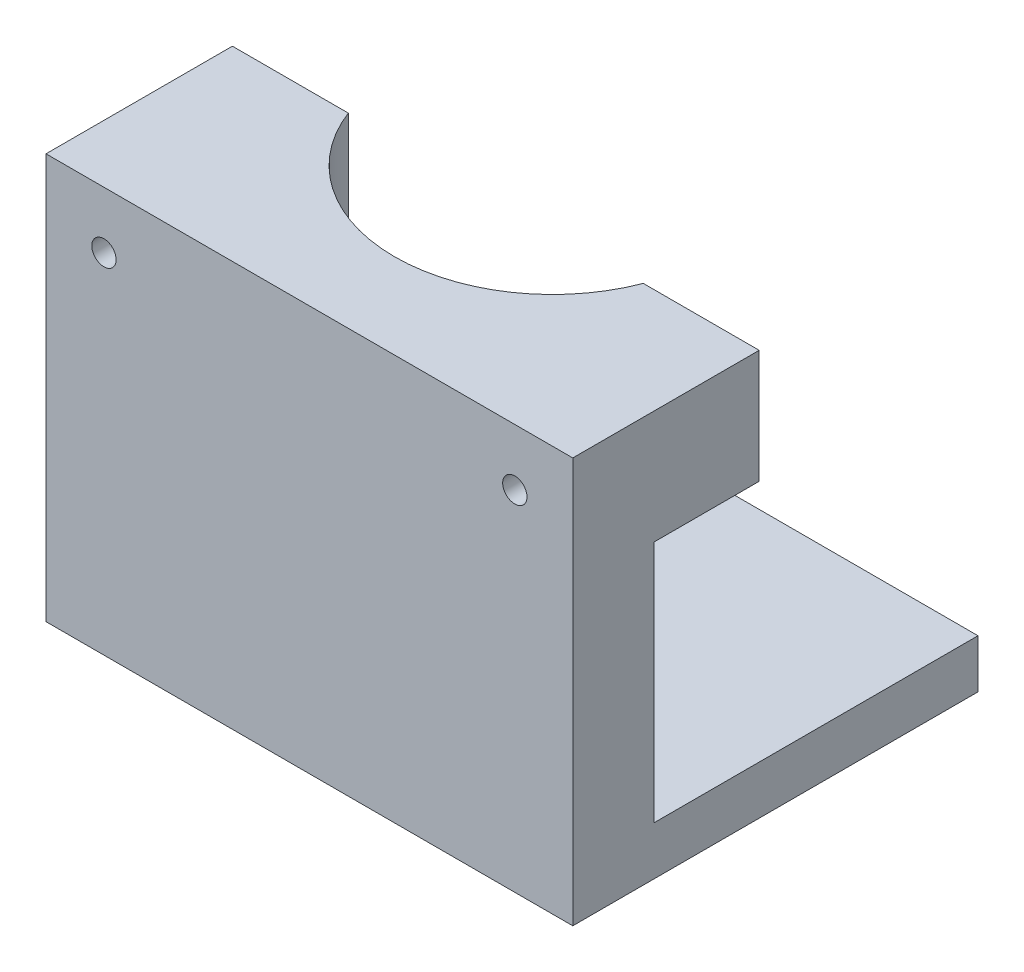
from build123d import *

# Parameters (mm, degrees)
SKETCH1_W           = 65
SKETCH1_H           = 50
BOSS_EXTRUDE1_DEPTH = 6
SKETCH2_W           = 65
SKETCH2_H           = 10
BOSS_EXTRUDE2_DEPTH = 30
BOSS_EXTRUDE3_DEPTH = 14
SKETCH4_R           = 1.5
CUT_EXTRUDE1_DEPTH  = 23


with BuildPart() as part:
    # Sketch1 → Boss-Extrude1 (new body)
    with BuildSketch(Plane(origin=(0, 0, 0), x_dir=(1, 0, 0), z_dir=(0, 1, 0))):
        with Locations((32.5, 25)):
            Rectangle(SKETCH1_W, SKETCH1_H)
    extrude(amount=BOSS_EXTRUDE1_DEPTH)

    # Sketch2 → Boss-Extrude2 (add)
    with BuildSketch(Plane(origin=(0, 6, 0), x_dir=(1, 0, 0), z_dir=(0, 1, 0))):
        with Locations((32.5, 5)):
            Rectangle(SKETCH2_W, SKETCH2_H)
    extrude(amount=BOSS_EXTRUDE2_DEPTH)

    # Sketch3 → Boss-Extrude3 (add)
    with BuildSketch(Plane(origin=(0, 36, 0), x_dir=(1, 0, 0), z_dir=(0, 1, 0))):
        with BuildLine():
            Line((0, 0), (65, 0))
            Line((65, 0), (65, 23))
            Line((65, 23), (50.700274723, 23))
            ThreePointArc((50.700274723, 23), (32.5, 10.5), (14.299725277, 23))
            Line((14.299725277, 23), (0, 23))
            Line((0, 23), (0, 0))
        make_face()
    extrude(amount=BOSS_EXTRUDE3_DEPTH)

    # Sketch4 → Cut-Extrude1 (cut)
    with BuildSketch(Plane(origin=(0, 0, -23), x_dir=(-1, 0, 0), z_dir=(0, 0, -1))):
        with Locations((-57.850137362, 43)):
            Circle(SKETCH4_R)
        with Locations((-7.149862638, 43)):
            Circle(SKETCH4_R)
    extrude(amount=-CUT_EXTRUDE1_DEPTH, mode=Mode.SUBTRACT)


solid = part.part
